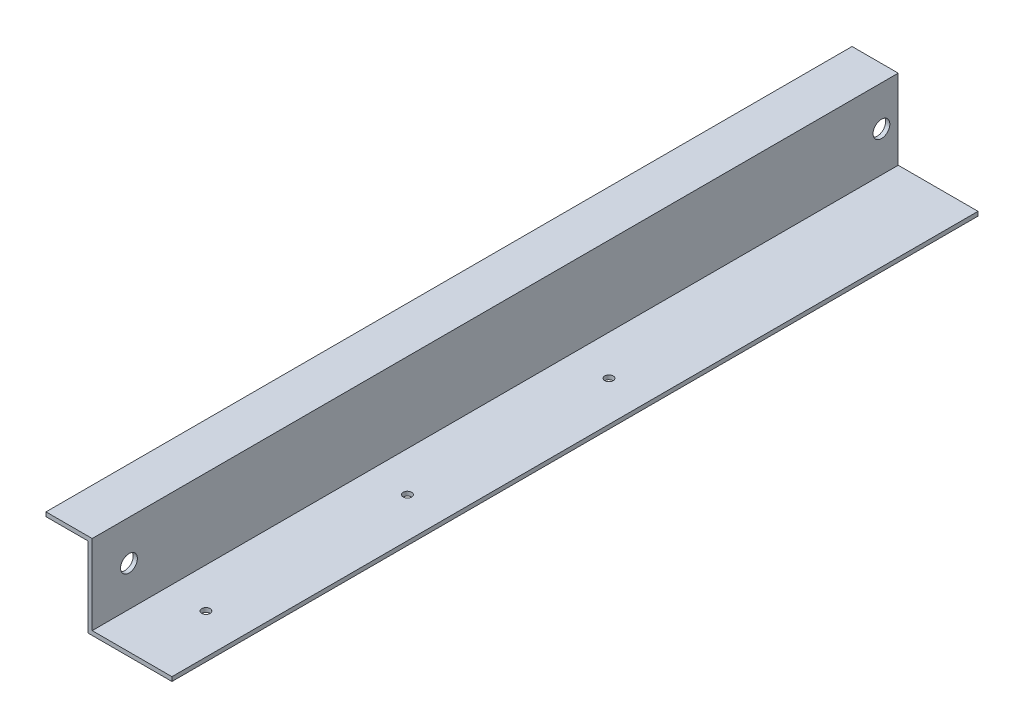
from build123d import *

# Parameters (mm, degrees)
BOSS_EXTRUDE1_DEPTH      = 152.4
BOSS_EXTRUDE1_DEPTH_BACK = 152.4
SKETCH4_R                = 1.5875
CUT_EXTRUDE1_DEPTH       = 1.5875
SKETCH5_R                = 3.175
CUT_EXTRUDE2_DEPTH       = 1.5875


with BuildPart() as part:
    # Sketch3 → Boss-Extrude1 (new, two sides: drawn at the far end of the back side and taken through both)
    with BuildSketch(Plane.XY.offset(-BOSS_EXTRUDE1_DEPTH_BACK)):
        Polygon((30.95625, -14.2875), (30.95625, -15.875), (-0.79375, -15.875), (-0.79375, 14.2875), (-16.66875, 14.2875), (-16.66875, 15.875), (0.79375, 15.875), (0.79375, -14.2875), align=None)
    extrude(amount=BOSS_EXTRUDE1_DEPTH + BOSS_EXTRUDE1_DEPTH_BACK)

    # Sketch4 → Cut-Extrude1 (cut)
    with BuildSketch(Plane(origin=(0, -14.2875, 0), x_dir=(1, 0, 0), z_dir=(0, 1, 0))):
        with Locations(Location((15.875, 27.94, 0), (0, 0, 270))):
            Circle(SKETCH4_R)
        with Locations(Location((15.875, -48.26, 0), (0, 0, 270))):
            Circle(SKETCH4_R)
        with Locations(Location((15.875, -124.46, 0), (0, 0, 270))):
            Circle(SKETCH4_R)
    extrude(amount=-CUT_EXTRUDE1_DEPTH, mode=Mode.SUBTRACT)

    # Sketch5 → Cut-Extrude2 (cut)
    with BuildSketch(Plane(origin=(0.79375, 0, 0), x_dir=(0, 0, -1), z_dir=(1, 0, 0))):
        with Locations((-138.4808, 0.79375)):
            Circle(SKETCH5_R)
        with Locations((146.05, 0.79375)):
            Circle(SKETCH5_R)
    extrude(amount=-CUT_EXTRUDE2_DEPTH, mode=Mode.SUBTRACT)


solid = part.part
